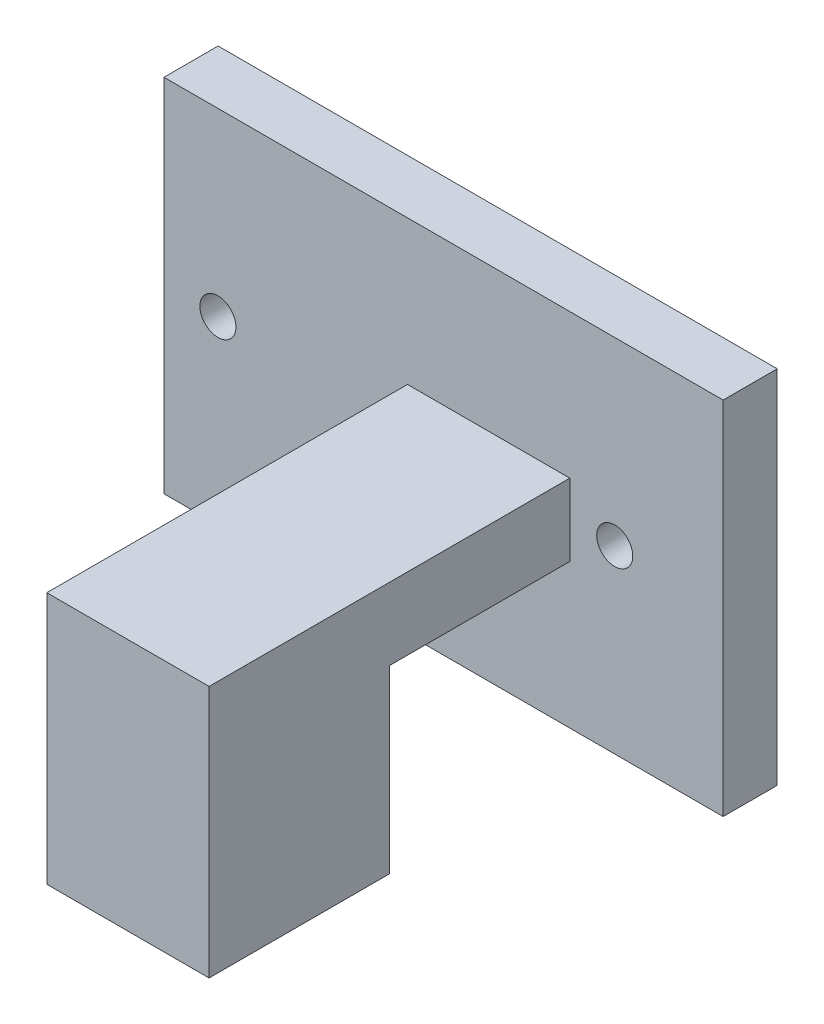
from build123d import *

# Parameters (mm, degrees)
ESQUISSE1_W             = 26
ESQUISSE1_H             = 20
BOSS_EXTRU_1_DEPTH      = 3
ESQUISSE2_R             = 1
ENL_V_MAT_EXTRU_1_DEPTH = 10
ESQUISSE3_W             = 9
ESQUISSE3_H             = 4
BOSS_EXTRU_2_DEPTH      = 20
ESQUISSE10_W            = 9
ESQUISSE10_H            = 10
BOSS_EXTRU_3_DEPTH      = 10
ENL_V_MAT_EXTRU_9_DEPTH = 5
ESQUISSE13_W            = 3
ESQUISSE13_H            = 20
BOSS_EXTRU_4_DEPTH      = 5


with BuildPart() as part:
    # Esquisse1 → Boss.-Extru.1 (new body)
    with BuildSketch(Plane.XY):
        with Locations((-10.76504298, -2.606017192)):
            Rectangle(ESQUISSE1_W, ESQUISSE1_H)
    extrude(amount=BOSS_EXTRU_1_DEPTH)

    # Esquisse2 → Enlèv. mat.-Extru.1 (cut)
    with BuildSketch(Plane.XY.offset(3)):
        with Locations((-20.77504298, -2.606017192)):
            Circle(ESQUISSE2_R)
        with Locations((1.22495702, -2.606017192)):
            Circle(ESQUISSE2_R)
    extrude(amount=-ENL_V_MAT_EXTRU_1_DEPTH, mode=Mode.SUBTRACT)

    # Esquisse3 → Boss.-Extru.2 (add)
    with BuildSketch(Plane.XY.offset(3)):
        with Locations((-5.76504298, -2.606017192)):
            Rectangle(ESQUISSE3_W, ESQUISSE3_H)
    extrude(amount=BOSS_EXTRU_2_DEPTH)

    # Esquisse10 → Boss.-Extru.3 (add)
    with BuildSketch(Plane(origin=(0, -4.606017192, 0), x_dir=(-1, 0, 0), z_dir=(0, -1, 0))):
        with Locations((5.76504298, -18)):
            Rectangle(ESQUISSE10_W, ESQUISSE10_H)
    extrude(amount=BOSS_EXTRU_3_DEPTH)

    # Esquisse12 → Enlèv. mat.-Extru.9 (cut)
    with BuildSketch(Plane.XZ.offset(14.606017192)):
        with BuildLine():
            Line((-1.76504298, 18), (-2.862370428, 18.757952542))
            ThreePointArc((-2.862370428, 18.757952542), (-2.867078041, 18.775757187), (-2.871894865, 18.793532598))
            Line((-2.871894865, 18.793532598), (-2.300941365, 20))
            Line((-2.300941365, 20), (-3.630231082, 20.107742433))
            ThreePointArc((-3.630231082, 20.107742433), (-3.643210317, 20.120807901), (-3.656269514, 20.133793446))
            Line((-3.656269514, 20.133793446), (-3.76504298, 21.464101615))
            Line((-3.76504298, 21.464101615), (-4.970112861, 20.89276444))
            ThreePointArc((-4.970112861, 20.89276444), (-4.987885942, 20.89758985), (-5.005688311, 20.902306063))
            Line((-5.005688311, 20.902306063), (-5.76504298, 22))
            Line((-5.76504298, 22), (-6.522995522, 20.902672552))
            ThreePointArc((-6.522995522, 20.902672552), (-6.540800167, 20.897964939), (-6.558575577, 20.893148115))
            Line((-6.558575577, 20.893148115), (-7.76504298, 21.464101615))
            Line((-7.76504298, 21.464101615), (-7.872785412, 20.134811898))
            ThreePointArc((-7.872785412, 20.134811898), (-7.885850881, 20.121832663), (-7.898836426, 20.108773466))
            Line((-7.898836426, 20.108773466), (-9.229144595, 20))
            Line((-9.229144595, 20), (-8.65780742, 18.794930119))
            ThreePointArc((-8.65780742, 18.794930119), (-8.66263283, 18.777157038), (-8.667349043, 18.759354669))
            Line((-8.667349043, 18.759354669), (-9.76504298, 18))
            Line((-9.76504298, 18), (-8.667715532, 17.242047458))
            ThreePointArc((-8.667715532, 17.242047458), (-8.663007919, 17.224242813), (-8.658191095, 17.206467402))
            Line((-8.658191095, 17.206467402), (-9.229144595, 16))
            Line((-9.229144595, 16), (-7.899854878, 15.892257567))
            ThreePointArc((-7.899854878, 15.892257567), (-7.886875643, 15.879192099), (-7.873816446, 15.866206554))
            Line((-7.873816446, 15.866206554), (-7.76504298, 14.535898385))
            Line((-7.76504298, 14.535898385), (-6.559973099, 15.10723556))
            ThreePointArc((-6.559973099, 15.10723556), (-6.542200018, 15.10241015), (-6.524397649, 15.097693937))
            Line((-6.524397649, 15.097693937), (-5.76504298, 14))
            Line((-5.76504298, 14), (-5.007090438, 15.097327448))
            ThreePointArc((-5.007090438, 15.097327448), (-4.989285793, 15.102035061), (-4.971510382, 15.106851885))
            Line((-4.971510382, 15.106851885), (-3.76504298, 14.535898385))
            Line((-3.76504298, 14.535898385), (-3.657300547, 15.865188102))
            ThreePointArc((-3.657300547, 15.865188102), (-3.644235079, 15.878167337), (-3.631249534, 15.891226534))
            Line((-3.631249534, 15.891226534), (-2.300941365, 16))
            Line((-2.300941365, 16), (-2.87227854, 17.205069881))
            ThreePointArc((-2.87227854, 17.205069881), (-2.86745313, 17.222842962), (-2.862736916, 17.240645331))
            Line((-2.862736916, 17.240645331), (-1.76504298, 18))
        make_face()
    extrude(amount=-ENL_V_MAT_EXTRU_9_DEPTH, mode=Mode.SUBTRACT)

    # Esquisse13 → Boss.-Extru.4 (add)
    with BuildSketch(Plane(origin=(2.23495702, 0, 0), x_dir=(0, 0, -1), z_dir=(1, 0, 0))):
        with Locations((-1.5, -2.606017192)):
            Rectangle(ESQUISSE13_W, ESQUISSE13_H)
    extrude(amount=BOSS_EXTRU_4_DEPTH)


solid = part.part
